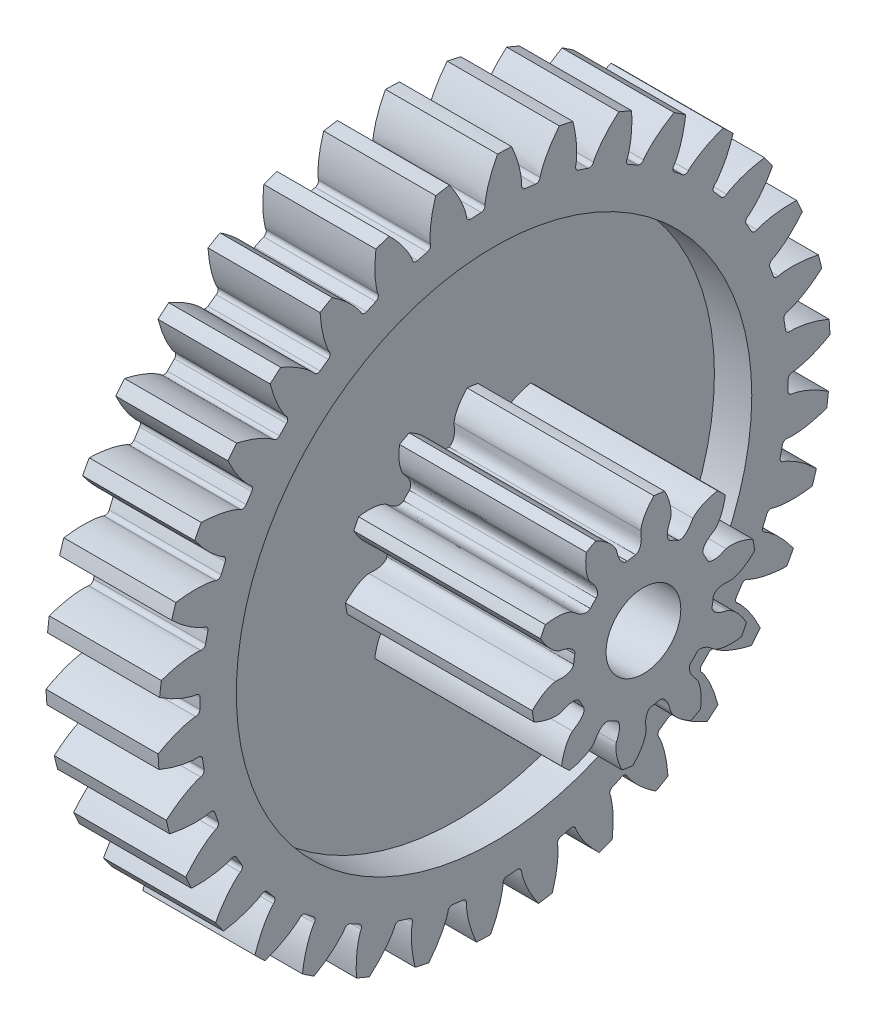
from build123d import *

# Parameters (mm, degrees)
ESQUISSE2_R             = 1
BOSS_EXTRU_1_DEPTH      = 3
ESQUISSE3_R             = 6.9
ENL_V_MAT_EXTRU_1_DEPTH = 1
ESQUISSE4_R             = 1
BOSS_EXTRU_2_DEPTH      = 5


with BuildPart() as part:
    # Esquisse2 → Boss.-Extru.1 (new body)
    with BuildSketch(Plane(origin=(0, 0, 0), x_dir=(0, 0, -1), z_dir=(1, 0, 0))):
        with BuildLine():
            ThreePointArc((8.992678526, 0.362950305), (8.983203595, 0.549593642), (8.969855294, 0.736000007))
            add(Edge.make_bspline(
                [(7.928017131, 0.973718567), (7.968735547, 0.978720051), (8.14599471, 0.972060465), (8.43210917, 0.923262044), (8.735368899, 0.829543111), (8.90576586, 0.762906571), (8.969855294, 0.736000007)],
                knots=[0, 0, 0, 0, 0.124841327, 0.52877899, 0.867841808, 1.076016146, 1.076016146, 1.076016146, 1.076016146], degree=3))
            ThreePointArc((7.928017131, 0.973718567), (7.845145349, 0.995861242), (7.801971612, 1.069983161))
            ThreePointArc((7.801971612, 1.069983161), (7.782401197, 1.204099918), (7.760525474, 1.337859996))
            ThreePointArc((7.760525474, 1.337859996), (7.7791127, 1.421320515), (7.851006147, 1.467607399))
            add(Edge.make_bspline(
                [(7.851006147, 1.467607399), (7.891911369, 1.47525391), (8.058869705, 1.535171146), (8.316858832, 1.668153777), (8.577616241, 1.849137964), (8.719907754, 1.964153953), (8.772869142, 2.009170729)],
                knots=[0, 0, 0, 0, 0.124841327, 0.52877899, 0.867841808, 1.076016146, 1.076016146, 1.076016146, 1.076016146], degree=3))
            ThreePointArc((8.772869142, 2.009170729), (8.729259916, 2.190895095), (8.681886815, 2.371674793))
            add(Edge.make_bspline(
                [(7.614107256, 2.413908484), (7.653213344, 2.426306797), (7.828678029, 2.452331888), (8.118887532, 2.456937748), (8.434204497, 2.420538386), (8.613944558, 2.38634682), (8.681886815, 2.371674793)],
                knots=[0, 0, 0, 0, 0.124841327, 0.52877899, 0.867841808, 1.076016146, 1.076016146, 1.076016146, 1.076016146], degree=3))
            ThreePointArc((7.614107256, 2.413908484), (7.528577818, 2.420446487), (7.472519329, 2.485373186))
            ThreePointArc((7.472519329, 2.485373186), (7.428638248, 2.613610296), (7.382556651, 2.741073201))
            ThreePointArc((7.382556651, 2.741073201), (7.385491564, 2.82652804), (7.447655696, 2.885237188))
            add(Edge.make_bspline(
                [(7.447655696, 2.885237188), (7.486459386, 2.900269817), (7.639565176, 2.989845363), (7.868726054, 3.167969089), (8.091787815, 3.393785724), (8.210522412, 3.532989345), (8.254310221, 3.586971254)],
                knots=[0, 0, 0, 0, 0.124841327, 0.52877899, 0.867841808, 1.076016146, 1.076016146, 1.076016146, 1.076016146], degree=3))
            ThreePointArc((8.254310221, 3.586971254), (8.17805176, 3.757588243), (8.098267094, 3.926585039))
            add(Edge.make_bspline(
                [(7.040908091, 3.771895641), (7.077070139, 3.791268575), (7.244765106, 3.849092091), (7.529186917, 3.906945383), (7.845823377, 3.92910513), (8.028785705, 3.928522889), (8.098267094, 3.926585039)],
                knots=[0, 0, 0, 0, 0.124841327, 0.52877899, 0.867841808, 1.076016146, 1.076016146, 1.076016146, 1.076016146], degree=3))
            ThreePointArc((7.040908091, 3.771895641), (6.955633599, 3.76260633), (6.888599363, 3.816126808))
            ThreePointArc((6.888599363, 3.816126808), (6.821901934, 3.93411731), (6.753183716, 4.050942446))
            ThreePointArc((6.753183716, 4.050942446), (6.740366371, 4.135481543), (6.790684263, 4.204613685))
            add(Edge.make_bspline(
                [(6.790684263, 4.204613685), (6.826065008, 4.226520515), (6.960104418, 4.342703981), (7.152633247, 4.559903013), (7.33040326, 4.822862182), (7.421537577, 4.981513022), (7.454660665, 5.042621775)],
                knots=[0, 0, 0, 0, 0.124841327, 0.52877899, 0.867841808, 1.076016146, 1.076016146, 1.076016146, 1.076016146], degree=3))
            ThreePointArc((7.454660665, 5.042621775), (7.34834986, 5.19632123), (7.2388706, 5.34778014))
            add(Edge.make_bspline(
                [(6.227939246, 5.001435417), (6.259925799, 5.027123248), (6.414140397, 5.114776078), (6.683088872, 5.223906679), (6.990262151, 5.303870911), (7.170216185, 5.336917824), (7.2388706, 5.34778014)],
                knots=[0, 0, 0, 0, 0.124841327, 0.52877899, 0.867841808, 1.076016146, 1.076016146, 1.076016146, 1.076016146], degree=3))
            ThreePointArc((6.227939246, 5.001435417), (6.14582362, 4.976635127), (6.070096408, 5.016926809))
            ThreePointArc((6.070096408, 5.016926809), (5.982853931, 5.120652678), (5.893839209, 5.222861704))
            ThreePointArc((5.893839209, 5.222861704), (5.865706085, 5.303606182), (5.902464222, 5.380807106))
            add(Edge.make_bspline(
                [(5.902464222, 5.380807106), (5.933217173, 5.408842125), (6.043625651, 5.547677024), (6.192966094, 5.79655491), (6.319390614, 6.087701853), (6.379821181, 6.260397247), (6.401151581, 6.32655186)],
                knots=[0, 0, 0, 0, 0.124841327, 0.52877899, 0.867841808, 1.076016146, 1.076016146, 1.076016146, 1.076016146], degree=3))
            ThreePointArc((6.401151581, 6.32655186), (6.268408719, 6.45809973), (6.13296305, 6.586863003))
            add(Edge.make_bspline(
                [(5.202885399, 6.060657308), (5.229607193, 6.091785269), (5.36508983, 6.206282501), (5.60940625, 6.362974098), (5.896655932, 6.498019729), (6.067473552, 6.563570423), (6.13296305, 6.586863003)],
                knots=[0, 0, 0, 0, 0.124841327, 0.52877899, 0.867841808, 1.076016146, 1.076016146, 1.076016146, 1.076016146], degree=3))
            ThreePointArc((5.202885399, 6.060657308), (5.126724989, 6.021190583), (5.044883599, 6.046881384))
            ThreePointArc((5.044883599, 6.046881384), (4.940067013, 6.13281036), (4.833787077, 6.216922671))
            ThreePointArc((4.833787077, 6.216922671), (4.791296214, 6.291122873), (4.813242841, 6.373763594))
            add(Edge.make_bspline(
                [(4.813242841, 6.373763594), (4.838320743, 6.406972104), (4.921338461, 6.563730579), (5.022404908, 6.835812081), (5.0931787, 7.145232139), (5.120847626, 7.326091153), (5.129658958, 7.395038808)],
                knots=[0, 0, 0, 0, 0.124841327, 0.52877899, 0.867841808, 1.076016146, 1.076016146, 1.076016146, 1.076016146], degree=3))
            ThreePointArc((5.129658958, 7.395038808), (4.975004437, 7.49995539), (4.818204799, 7.601638147))
            add(Edge.make_bspline(
                [(4.00065353, 6.913490784), (4.021200587, 6.948998848), (4.133337563, 7.086441417), (4.344702027, 7.285358066), (4.602246167, 7.470886279), (4.758110384, 7.566708503), (4.818204799, 7.601638147)],
                knots=[0, 0, 0, 0, 0.124841327, 0.52877899, 0.867841808, 1.076016146, 1.076016146, 1.076016146, 1.076016146], degree=3))
            ThreePointArc((4.00065353, 6.913490784), (3.933041887, 6.860701616), (3.84787333, 6.870916666))
            ThreePointArc((3.84787333, 6.870916666), (3.729052038, 6.936122541), (3.609126123, 6.999273793))
            ThreePointArc((3.609126123, 6.999273793), (3.553724497, 7.06440292), (3.560112248, 7.149669208))
            add(Edge.make_bspline(
                [(3.560112248, 7.149669208), (3.578661103, 7.186920332), (3.631460993, 7.356264162), (3.680811746, 7.64228387), (3.693524693, 7.959440113), (3.687489747, 8.142303811), (3.683481951, 8.21169658)],
                knots=[0, 0, 0, 0, 0.124841327, 0.52877899, 0.867841808, 1.076016146, 1.076016146, 1.076016146, 1.076016146], degree=3))
            ThreePointArc((3.683481951, 8.21169658), (3.512182346, 8.286409063), (3.339368362, 8.35754862))
            add(Edge.make_bspline(
                [(2.662184203, 7.530893622), (2.675856818, 7.569572607), (2.760829443, 7.72528007), (2.932044187, 7.959647903), (3.151112429, 8.189340757), (3.286715474, 8.3121714), (3.339368362, 8.35754862)],
                knots=[0, 0, 0, 0, 0.124841327, 0.52877899, 0.867841808, 1.076016146, 1.076016146, 1.076016146, 1.076016146], degree=3))
            ThreePointArc((2.662184203, 7.530893622), (2.605423761, 7.466579684), (2.51982835, 7.460971122))
            ThreePointArc((2.51982835, 7.460971122), (2.391048668, 7.503233388), (2.261560708, 7.543273041))
            ThreePointArc((2.261560708, 7.543273041), (2.195134954, 7.597113198), (2.185746302, 7.682101412))
            add(Edge.make_bspline(
                [(2.185746302, 7.682101412), (2.197134452, 7.722126608), (2.217918476, 7.898288992), (2.213872956, 8.188506848), (2.168092134, 8.502598901), (2.128558827, 8.681240079), (2.111868384, 8.748714873)],
                knots=[0, 0, 0, 0, 0.124841327, 0.52877899, 0.867841808, 1.076016146, 1.076016146, 1.076016146, 1.076016146], degree=3))
            ThreePointArc((2.111868384, 8.748714873), (1.929757098, 8.790679015), (1.74681374, 8.8288528))
            add(Edge.make_bspline(
                [(1.233057386, 7.891840911), (1.239389954, 7.932373648), (1.294304588, 8.101043575), (1.419539098, 8.362881478), (1.592671336, 8.628917058), (1.70339541, 8.77457327), (1.74681374, 8.8288528)],
                knots=[0, 0, 0, 0, 0.124841327, 0.52877899, 0.867841808, 1.076016146, 1.076016146, 1.076016146, 1.076016146], degree=3))
            ThreePointArc((1.233057386, 7.891840911), (1.189081054, 7.818192336), (1.105973638, 7.796951155))
            ThreePointArc((1.105973638, 7.796951155), (0.971621004, 7.81483062), (0.836980555, 7.830395172))
            ThreePointArc((0.836980555, 7.830395172), (0.761792723, 7.871112898), (0.736947387, 7.952928866))
            add(Edge.make_bspline(
                [(0.736947387, 7.952928866), (0.740787022, 7.994365125), (0.728847405, 8.171347063), (0.671543377, 8.455880046), (0.568827797, 8.756211882), (0.49714239, 8.924547128), (0.468337672, 8.987806174)],
                knots=[0, 0, 0, 0, 0.124841327, 0.52877899, 0.867841808, 1.076016146, 1.076016146, 1.076016146, 1.076016146], degree=3))
            ThreePointArc((0.468337672, 8.987806174), (0.281616286, 8.995592936), (0.094773472, 8.999500986))
            add(Edge.make_bspline(
                [(-0.238059721, 7.984041022), (-0.239282848, 8.02504722), (-0.216296258, 8.200935757), (-0.141306691, 8.481327153), (-0.020006268, 8.774645937), (0.062068259, 8.938167571), (0.094773472, 8.999500986)],
                knots=[0, 0, 0, 0, 0.124841327, 0.52877899, 0.867841808, 1.076016146, 1.076016146, 1.076016146, 1.076016146], degree=3))
            ThreePointArc((-0.238059721, 7.984041022), (-0.267754383, 7.903565825), (-0.34554368, 7.867415368))
            ThreePointArc((-0.34554368, 7.867415368), (-0.480894049, 7.860303169), (-0.616101967, 7.850862587))
            ThreePointArc((-0.616101967, 7.850862587), (-0.697491446, 7.877071289), (-0.736947387, 7.952928866))
            add(Edge.make_bspline(
                [(-0.736947387, 7.952928866), (-0.740787022, 7.994365125), (-0.78504369, 8.166139711), (-0.893654807, 8.435298391), (-1.049807289, 8.711642568), (-1.151203635, 8.863939428), (-1.191141718, 8.920828516)],
                knots=[0, 0, 0, 0, 0.124841327, 0.52877899, 0.867841808, 1.076016146, 1.076016146, 1.076016146, 1.076016146], degree=3))
            ThreePointArc((-1.191141718, 8.920828516), (-1.376114631, 8.894172728), (-1.560494193, 8.863681959))
            add(Edge.make_bspline(
                [(-1.70106999, 7.804354193), (-1.70980716, 7.844437433), (-1.719531394, 8.021554909), (-1.697340451, 8.310951405), (-1.632002584, 8.621564774), (-1.581372552, 8.797383295), (-1.560494193, 8.863681959)],
                knots=[0, 0, 0, 0, 0.124841327, 0.52877899, 0.867841808, 1.076016146, 1.076016146, 1.076016146, 1.076016146], degree=3))
            ThreePointArc((-1.70106999, 7.804354193), (-1.715471765, 7.719792859), (-1.785293922, 7.669964186))
            ThreePointArc((-1.785293922, 7.669964186), (-1.917032831, 7.638102521), (-2.048203875, 7.603978293))
            ThreePointArc((-2.048203875, 7.603978293), (-2.13302338, 7.614785465), (-2.185746302, 7.682101412))
            add(Edge.make_bspline(
                [(-2.185746302, 7.682101412), (-2.197134452, 7.722126608), (-2.272201064, 7.882844264), (-2.428420647, 8.127462766), (-2.632692446, 8.370408715), (-2.760346802, 8.501480902), (-2.810058205, 8.550062742)],
                knots=[0, 0, 0, 0, 0.124841327, 0.52877899, 0.867841808, 1.076016146, 1.076016146, 1.076016146, 1.076016146], degree=3))
            ThreePointArc((-2.810058205, 8.550062742), (-2.986983615, 8.489872136), (-3.1626211, 8.426020875))
            add(Edge.make_bspline(
                [(-3.106152361, 7.358899441), (-3.12210604, 7.396694737), (-3.164209951, 7.569009628), (-3.195573318, 7.857556174), (-3.188423008, 8.174886562), (-3.170961618, 8.357014683), (-3.1626211, 8.426020875)],
                knots=[0, 0, 0, 0, 0.124841327, 0.52877899, 0.867841808, 1.076016146, 1.076016146, 1.076016146, 1.076016146], degree=3))
            ThreePointArc((-3.106152361, 7.358899441), (-3.104770813, 7.273131606), (-3.164248122, 7.211321573))
            ThreePointArc((-3.164248122, 7.211321573), (-3.287889359, 7.155795453), (-3.410556657, 7.098149639))
            ThreePointArc((-3.410556657, 7.098149639), (-3.49591776, 7.093187254), (-3.560112248, 7.149669208))
            add(Edge.make_bspline(
                [(-3.560112248, 7.149669208), (-3.578661103, 7.186920332), (-3.681981355, 7.331108011), (-3.880489536, 7.542856145), (-4.125924419, 7.744130633), (-4.275489668, 7.84951464), (-4.33328153, 7.888134836)],
                knots=[0, 0, 0, 0, 0.124841327, 0.52877899, 0.867841808, 1.076016146, 1.076016146, 1.076016146, 1.076016146], degree=3))
            ThreePointArc((-4.33328153, 7.888134836), (-4.496134454, 7.79645913), (-4.657048739, 7.701421755))
            add(Edge.make_bspline(
                [(-4.405458438, 6.662846196), (-4.428085343, 6.697066474), (-4.501135134, 6.858710803), (-4.584984768, 7.136581292), (-4.636265512, 7.449822393), (-4.652567389, 7.632057959), (-4.657048739, 7.701421755)],
                knots=[0, 0, 0, 0, 0.124841327, 0.52877899, 0.867841808, 1.076016146, 1.076016146, 1.076016146, 1.076016146], degree=3))
            ThreePointArc((-4.405458438, 6.662846196), (-4.388340616, 6.578792579), (-4.435447646, 6.507106053))
            ThreePointArc((-4.435447646, 6.507106053), (-4.546780759, 6.429806352), (-4.656767022, 6.350602011))
            ThreePointArc((-4.656767022, 6.350602011), (-4.739762855, 6.330039059), (-4.813242841, 6.373763594))
            add(Edge.make_bspline(
                [(-4.813242841, 6.373763594), (-4.838320743, 6.406972104), (-4.966376188, 6.529719667), (-5.200413007, 6.701386604), (-5.478652985, 6.85413547), (-5.645035862, 6.930242572), (-5.70894015, 6.957585958)],
                knots=[0, 0, 0, 0, 0.124841327, 0.52877899, 0.867841808, 1.076016146, 1.076016146, 1.076016146, 1.076016146], degree=3))
            ThreePointArc((-5.70894015, 6.957585958), (-5.852174827, 6.83754706), (-5.992886168, 6.714559954))
            add(Edge.make_bspline(
                [(-5.554741912, 5.739897714), (-5.58327151, 5.769377644), (-5.684779557, 5.914846807), (-5.81826006, 6.172578694), (-5.926225553, 6.471063457), (-5.975735558, 6.647200654), (-5.992886168, 6.714559954)],
                knots=[0, 0, 0, 0, 0.124841327, 0.52877899, 0.867841808, 1.076016146, 1.076016146, 1.076016146, 1.076016146], degree=3))
            ThreePointArc((-5.554741912, 5.739897714), (-5.522470742, 5.660420661), (-5.555603321, 5.58129884))
            ThreePointArc((-5.555603321, 5.58129884), (-5.650836993, 5.484857908), (-5.744396771, 5.386792249))
            ThreePointArc((-5.744396771, 5.386792249), (-5.82220101, 5.351328976), (-5.902464222, 5.380807106))
            add(Edge.make_bspline(
                [(-5.902464222, 5.380807106), (-5.933217173, 5.408842125), (-6.081647036, 5.505969552), (-6.34324265, 5.63170938), (-6.644812595, 5.730730945), (-6.82234713, 5.774969405), (-6.89018766, 5.790104836)],
                knots=[0, 0, 0, 0, 0.124841327, 0.52877899, 0.867841808, 1.076016146, 1.076016146, 1.076016146, 1.076016146], degree=3))
            ThreePointArc((-6.89018766, 5.790104836), (-7.008926405, 5.645790525), (-7.124643046, 5.499041868))
            add(Edge.make_bspline(
                [(-6.514865313, 4.6214839), (-6.548326063, 4.645219578), (-6.674835631, 4.769559798), (-6.853401485, 4.998376331), (-7.014375092, 5.271940217), (-7.095407219, 5.435980904), (-7.124643046, 5.499041868)],
                knots=[0, 0, 0, 0, 0.124841327, 0.52877899, 0.867841808, 1.076016146, 1.076016146, 1.076016146, 1.076016146], degree=3))
            ThreePointArc((-6.514865313, 4.6214839), (-6.46853975, 4.549289907), (-6.486569587, 4.46542719))
            ThreePointArc((-6.486569587, 4.46542719), (-6.562460751, 4.353129207), (-6.636407979, 4.239541737))
            ThreePointArc((-6.636407979, 4.239541737), (-6.706371093, 4.190385802), (-6.790684263, 4.204613685))
            add(Edge.make_bspline(
                [(-6.790684263, 4.204613685), (-6.826065008, 4.226520515), (-6.989814688, 4.294720246), (-7.270060773, 4.370251048), (-7.584691081, 4.41217325), (-7.767331549, 4.423036581), (-7.836798093, 4.425448638)],
                knots=[0, 0, 0, 0, 0.124841327, 0.52877899, 0.867841808, 1.076016146, 1.076016146, 1.076016146, 1.076016146], degree=3))
            ThreePointArc((-7.836798093, 4.425448638), (-7.9269974, 4.261773366), (-8.013778751, 4.096260505))
            add(Edge.make_bspline(
                [(-7.253132789, 3.345690994), (-7.290385226, 3.362874131), (-7.437588183, 3.46185115), (-7.655158542, 3.653960257), (-7.863658499, 3.893287376), (-7.973453297, 4.039645344), (-8.013778751, 4.096260505)],
                knots=[0, 0, 0, 0, 0.124841327, 0.52877899, 0.867841808, 1.076016146, 1.076016146, 1.076016146, 1.076016146], degree=3))
            ThreePointArc((-7.253132789, 3.345690994), (-7.194330395, 3.283238541), (-7.196643507, 3.197490772))
            ThreePointArc((-7.196643507, 3.197490772), (-7.250607779, 3.073159911), (-7.302424271, 2.947918717))
            ThreePointArc((-7.302424271, 2.947918717), (-7.362163751, 2.886744066), (-7.447655696, 2.885237188))
            add(Edge.make_bspline(
                [(-7.447655696, 2.885237188), (-7.486459386, 2.900269817), (-7.659952585, 2.937219394), (-7.949305695, 2.959969057), (-8.266282009, 2.943364287), (-8.447808808, 2.920482551), (-8.516535767, 2.910089094)],
                knots=[0, 0, 0, 0, 0.124841327, 0.52877899, 0.867841808, 1.076016146, 1.076016146, 1.076016146, 1.076016146], degree=3))
            ThreePointArc((-8.516535767, 2.910089094), (-8.575124006, 2.732626625), (-8.630014832, 2.553985905))
            add(Edge.make_bspline(
                [(-7.744403527, 1.955964595), (-7.784179063, 1.966010038), (-7.94706259, 2.036253313), (-8.196228356, 2.185112949), (-8.445154448, 2.382053302), (-8.579972987, 2.505744507), (-8.630014832, 2.553985905)],
                knots=[0, 0, 0, 0, 0.124841327, 0.52877899, 0.867841808, 1.076016146, 1.076016146, 1.076016146, 1.076016146], degree=3))
            ThreePointArc((-7.744403527, 1.955964595), (-7.675126748, 1.905380425), (-7.661644363, 1.820667641))
            ThreePointArc((-7.661644363, 1.820667641), (-7.691844055, 1.68853784), (-7.719765264, 1.55590786))
            ThreePointArc((-7.719765264, 1.55590786), (-7.767246753, 1.484797724), (-7.851006147, 1.467607399))
            add(Edge.make_bspline(
                [(-7.851006147, 1.467607399), (-7.891911369, 1.47525391), (-8.069239983, 1.479695059), (-8.357846547, 1.448888871), (-8.666374618, 1.374322583), (-8.84060607, 1.318474991), (-8.906253029, 1.295629957)],
                knots=[0, 0, 0, 0, 0.124841327, 0.52877899, 0.867841808, 1.076016146, 1.076016146, 1.076016146, 1.076016146], degree=3))
            ThreePointArc((-8.906253029, 1.295629957), (-8.93123505, 1.110423563), (-8.952366108, 0.924738377))
            add(Edge.make_bspline(
                [(-7.971947891, 0.499630167), (-8.012892019, 0.502195832), (-8.185909312, 0.541313312), (-8.458185443, 0.641854241), (-8.73906079, 0.78970126), (-8.894311987, 0.886513545), (-8.952366108, 0.924738377)],
                knots=[0, 0, 0, 0, 0.124841327, 0.52877899, 0.867841808, 1.076016146, 1.076016146, 1.076016146, 1.076016146], degree=3))
            ThreePointArc((-7.971947891, 0.499630167), (-7.894555864, 0.462636863), (-7.865737109, 0.381843858))
            ThreePointArc((-7.865737109, 0.381843858), (-7.871143807, 0.246414639), (-7.874218909, 0.110912427))
            ThreePointArc((-7.874218909, 0.110912427), (-7.907825483, 0.032288375), (-7.987, 0))
            add(Edge.make_bspline(
                [(-7.987, 0), (-8.028613776, 0), (-8.203739092, -0.028218518), (-8.481770958, -0.111531489), (-8.771344233, -0.241520028), (-8.932347096, -0.328431654), (-8.992678526, -0.362950305)],
                knots=[0, 0, 0, 0, 0.124841327, 0.52877899, 0.867841808, 1.076016146, 1.076016146, 1.076016146, 1.076016146], degree=3))
            ThreePointArc((-8.992678526, -0.362950305), (-8.983203595, -0.549593642), (-8.969855294, -0.736000007))
            add(Edge.make_bspline(
                [(-7.928017131, -0.973718567), (-7.968735547, -0.978720051), (-8.14599471, -0.972060465), (-8.43210917, -0.923262044), (-8.735368899, -0.829543111), (-8.90576586, -0.762906571), (-8.969855294, -0.736000007)],
                knots=[0, 0, 0, 0, 0.124841327, 0.52877899, 0.867841808, 1.076016146, 1.076016146, 1.076016146, 1.076016146], degree=3))
            ThreePointArc((-7.928017131, -0.973718567), (-7.845145349, -0.995861242), (-7.801971612, -1.069983161))
            ThreePointArc((-7.801971612, -1.069983161), (-7.782401197, -1.204099918), (-7.760525474, -1.337859996))
            ThreePointArc((-7.760525474, -1.337859996), (-7.7791127, -1.421320515), (-7.851006147, -1.467607399))
            add(Edge.make_bspline(
                [(-7.851006147, -1.467607399), (-7.891911369, -1.47525391), (-8.058869705, -1.535171146), (-8.316858832, -1.668153777), (-8.577616241, -1.849137964), (-8.719907754, -1.964153953), (-8.772869142, -2.009170729)],
                knots=[0, 0, 0, 0, 0.124841327, 0.52877899, 0.867841808, 1.076016146, 1.076016146, 1.076016146, 1.076016146], degree=3))
            ThreePointArc((-8.772869142, -2.009170729), (-8.729259916, -2.190895095), (-8.681886815, -2.371674793))
            add(Edge.make_bspline(
                [(-7.614107256, -2.413908484), (-7.653213344, -2.426306797), (-7.828678029, -2.452331888), (-8.118887532, -2.456937748), (-8.434204497, -2.420538386), (-8.613944558, -2.38634682), (-8.681886815, -2.371674793)],
                knots=[0, 0, 0, 0, 0.124841327, 0.52877899, 0.867841808, 1.076016146, 1.076016146, 1.076016146, 1.076016146], degree=3))
            ThreePointArc((-7.614107256, -2.413908484), (-7.528577818, -2.420446487), (-7.472519329, -2.485373186))
            ThreePointArc((-7.472519329, -2.485373186), (-7.428638248, -2.613610296), (-7.382556651, -2.741073201))
            ThreePointArc((-7.382556651, -2.741073201), (-7.385491564, -2.82652804), (-7.447655696, -2.885237188))
            add(Edge.make_bspline(
                [(-7.447655696, -2.885237188), (-7.486459386, -2.900269817), (-7.639565176, -2.989845363), (-7.868726054, -3.167969089), (-8.091787815, -3.393785724), (-8.210522412, -3.532989345), (-8.254310221, -3.586971254)],
                knots=[0, 0, 0, 0, 0.124841327, 0.52877899, 0.867841808, 1.076016146, 1.076016146, 1.076016146, 1.076016146], degree=3))
            ThreePointArc((-8.254310221, -3.586971254), (-8.17805176, -3.757588243), (-8.098267094, -3.926585039))
            add(Edge.make_bspline(
                [(-7.040908091, -3.771895641), (-7.077070139, -3.791268575), (-7.244765106, -3.849092091), (-7.529186917, -3.906945383), (-7.845823377, -3.92910513), (-8.028785705, -3.928522889), (-8.098267094, -3.926585039)],
                knots=[0, 0, 0, 0, 0.124841327, 0.52877899, 0.867841808, 1.076016146, 1.076016146, 1.076016146, 1.076016146], degree=3))
            ThreePointArc((-7.040908091, -3.771895641), (-6.955633599, -3.76260633), (-6.888599363, -3.816126808))
            ThreePointArc((-6.888599363, -3.816126808), (-6.821901934, -3.93411731), (-6.753183716, -4.050942446))
            ThreePointArc((-6.753183716, -4.050942446), (-6.740366371, -4.135481543), (-6.790684263, -4.204613685))
            add(Edge.make_bspline(
                [(-6.790684263, -4.204613685), (-6.826065008, -4.226520515), (-6.960104418, -4.342703981), (-7.152633247, -4.559903013), (-7.33040326, -4.822862182), (-7.421537577, -4.981513022), (-7.454660665, -5.042621775)],
                knots=[0, 0, 0, 0, 0.124841327, 0.52877899, 0.867841808, 1.076016146, 1.076016146, 1.076016146, 1.076016146], degree=3))
            ThreePointArc((-7.454660665, -5.042621775), (-7.34834986, -5.19632123), (-7.2388706, -5.34778014))
            add(Edge.make_bspline(
                [(-6.227939246, -5.001435417), (-6.259925799, -5.027123248), (-6.414140397, -5.114776078), (-6.683088872, -5.223906679), (-6.990262151, -5.303870911), (-7.170216185, -5.336917824), (-7.2388706, -5.34778014)],
                knots=[0, 0, 0, 0, 0.124841327, 0.52877899, 0.867841808, 1.076016146, 1.076016146, 1.076016146, 1.076016146], degree=3))
            ThreePointArc((-6.227939246, -5.001435417), (-6.14582362, -4.976635127), (-6.070096408, -5.016926809))
            ThreePointArc((-6.070096408, -5.016926809), (-5.982853931, -5.120652678), (-5.893839209, -5.222861704))
            ThreePointArc((-5.893839209, -5.222861704), (-5.865706085, -5.303606182), (-5.902464222, -5.380807106))
            add(Edge.make_bspline(
                [(-5.902464222, -5.380807106), (-5.933217173, -5.408842125), (-6.043625651, -5.547677024), (-6.192966094, -5.79655491), (-6.319390614, -6.087701853), (-6.379821181, -6.260397247), (-6.401151581, -6.32655186)],
                knots=[0, 0, 0, 0, 0.124841327, 0.52877899, 0.867841808, 1.076016146, 1.076016146, 1.076016146, 1.076016146], degree=3))
            ThreePointArc((-6.401151581, -6.32655186), (-6.268408719, -6.45809973), (-6.13296305, -6.586863003))
            add(Edge.make_bspline(
                [(-5.202885399, -6.060657308), (-5.229607193, -6.091785269), (-5.36508983, -6.206282501), (-5.60940625, -6.362974098), (-5.896655932, -6.498019729), (-6.067473552, -6.563570423), (-6.13296305, -6.586863003)],
                knots=[0, 0, 0, 0, 0.124841327, 0.52877899, 0.867841808, 1.076016146, 1.076016146, 1.076016146, 1.076016146], degree=3))
            ThreePointArc((-5.202885399, -6.060657308), (-5.126724989, -6.021190583), (-5.044883599, -6.046881384))
            ThreePointArc((-5.044883599, -6.046881384), (-4.940067013, -6.13281036), (-4.833787077, -6.216922671))
            ThreePointArc((-4.833787077, -6.216922671), (-4.791296214, -6.291122873), (-4.813242841, -6.373763594))
            add(Edge.make_bspline(
                [(-4.813242841, -6.373763594), (-4.838320743, -6.406972104), (-4.921338461, -6.563730579), (-5.022404908, -6.835812081), (-5.0931787, -7.145232139), (-5.120847626, -7.326091153), (-5.129658958, -7.395038808)],
                knots=[0, 0, 0, 0, 0.124841327, 0.52877899, 0.867841808, 1.076016146, 1.076016146, 1.076016146, 1.076016146], degree=3))
            ThreePointArc((-5.129658958, -7.395038808), (-4.975004437, -7.49995539), (-4.818204799, -7.601638147))
            add(Edge.make_bspline(
                [(-4.00065353, -6.913490784), (-4.021200587, -6.948998848), (-4.133337563, -7.086441417), (-4.344702027, -7.285358066), (-4.602246167, -7.470886279), (-4.758110384, -7.566708503), (-4.818204799, -7.601638147)],
                knots=[0, 0, 0, 0, 0.124841327, 0.52877899, 0.867841808, 1.076016146, 1.076016146, 1.076016146, 1.076016146], degree=3))
            ThreePointArc((-4.00065353, -6.913490784), (-3.933041887, -6.860701616), (-3.84787333, -6.870916666))
            ThreePointArc((-3.84787333, -6.870916666), (-3.729052038, -6.936122541), (-3.609126123, -6.999273793))
            ThreePointArc((-3.609126123, -6.999273793), (-3.553724497, -7.06440292), (-3.560112248, -7.149669208))
            add(Edge.make_bspline(
                [(-3.560112248, -7.149669208), (-3.578661103, -7.186920332), (-3.631460993, -7.356264162), (-3.680811746, -7.64228387), (-3.693524693, -7.959440113), (-3.687489747, -8.142303811), (-3.683481951, -8.21169658)],
                knots=[0, 0, 0, 0, 0.124841327, 0.52877899, 0.867841808, 1.076016146, 1.076016146, 1.076016146, 1.076016146], degree=3))
            ThreePointArc((-3.683481951, -8.21169658), (-3.512182346, -8.286409063), (-3.339368362, -8.35754862))
            add(Edge.make_bspline(
                [(-2.662184203, -7.530893622), (-2.675856818, -7.569572607), (-2.760829443, -7.72528007), (-2.932044187, -7.959647903), (-3.151112429, -8.189340757), (-3.286715474, -8.3121714), (-3.339368362, -8.35754862)],
                knots=[0, 0, 0, 0, 0.124841327, 0.52877899, 0.867841808, 1.076016146, 1.076016146, 1.076016146, 1.076016146], degree=3))
            ThreePointArc((-2.662184203, -7.530893622), (-2.605423761, -7.466579684), (-2.51982835, -7.460971122))
            ThreePointArc((-2.51982835, -7.460971122), (-2.391048668, -7.503233388), (-2.261560708, -7.543273041))
            ThreePointArc((-2.261560708, -7.543273041), (-2.195134954, -7.597113198), (-2.185746302, -7.682101412))
            add(Edge.make_bspline(
                [(-2.185746302, -7.682101412), (-2.197134452, -7.722126608), (-2.217918476, -7.898288992), (-2.213872956, -8.188506848), (-2.168092134, -8.502598901), (-2.128558827, -8.681240079), (-2.111868384, -8.748714873)],
                knots=[0, 0, 0, 0, 0.124841327, 0.52877899, 0.867841808, 1.076016146, 1.076016146, 1.076016146, 1.076016146], degree=3))
            ThreePointArc((-2.111868384, -8.748714873), (-1.929757098, -8.790679015), (-1.74681374, -8.8288528))
            add(Edge.make_bspline(
                [(-1.233057386, -7.891840911), (-1.239389954, -7.932373648), (-1.294304588, -8.101043575), (-1.419539098, -8.362881478), (-1.592671336, -8.628917058), (-1.70339541, -8.77457327), (-1.74681374, -8.8288528)],
                knots=[0, 0, 0, 0, 0.124841327, 0.52877899, 0.867841808, 1.076016146, 1.076016146, 1.076016146, 1.076016146], degree=3))
            ThreePointArc((-1.233057386, -7.891840911), (-1.189081054, -7.818192336), (-1.105973638, -7.796951155))
            ThreePointArc((-1.105973638, -7.796951155), (-0.971621004, -7.81483062), (-0.836980555, -7.830395172))
            ThreePointArc((-0.836980555, -7.830395172), (-0.761792723, -7.871112898), (-0.736947387, -7.952928866))
            add(Edge.make_bspline(
                [(-0.736947387, -7.952928866), (-0.740787022, -7.994365125), (-0.728847405, -8.171347063), (-0.671543377, -8.455880046), (-0.568827797, -8.756211882), (-0.49714239, -8.924547128), (-0.468337672, -8.987806174)],
                knots=[0, 0, 0, 0, 0.124841327, 0.52877899, 0.867841808, 1.076016146, 1.076016146, 1.076016146, 1.076016146], degree=3))
            ThreePointArc((-0.468337672, -8.987806174), (-0.281616286, -8.995592936), (-0.094773472, -8.999500986))
            add(Edge.make_bspline(
                [(0.238059721, -7.984041022), (0.239282848, -8.02504722), (0.216296258, -8.200935757), (0.141306691, -8.481327153), (0.020006268, -8.774645937), (-0.062068259, -8.938167571), (-0.094773472, -8.999500986)],
                knots=[0, 0, 0, 0, 0.124841327, 0.52877899, 0.867841808, 1.076016146, 1.076016146, 1.076016146, 1.076016146], degree=3))
            ThreePointArc((0.238059721, -7.984041022), (0.267754383, -7.903565825), (0.34554368, -7.867415368))
            ThreePointArc((0.34554368, -7.867415368), (0.480894049, -7.860303169), (0.616101967, -7.850862587))
            ThreePointArc((0.616101967, -7.850862587), (0.697491446, -7.877071289), (0.736947387, -7.952928866))
            add(Edge.make_bspline(
                [(0.736947387, -7.952928866), (0.740787022, -7.994365125), (0.78504369, -8.166139711), (0.893654807, -8.435298391), (1.049807289, -8.711642568), (1.151203635, -8.863939428), (1.191141718, -8.920828516)],
                knots=[0, 0, 0, 0, 0.124841327, 0.52877899, 0.867841808, 1.076016146, 1.076016146, 1.076016146, 1.076016146], degree=3))
            ThreePointArc((1.191141718, -8.920828516), (1.376114631, -8.894172728), (1.560494193, -8.863681959))
            add(Edge.make_bspline(
                [(1.70106999, -7.804354193), (1.70980716, -7.844437433), (1.719531394, -8.021554909), (1.697340451, -8.310951405), (1.632002584, -8.621564774), (1.581372552, -8.797383295), (1.560494193, -8.863681959)],
                knots=[0, 0, 0, 0, 0.124841327, 0.52877899, 0.867841808, 1.076016146, 1.076016146, 1.076016146, 1.076016146], degree=3))
            ThreePointArc((1.70106999, -7.804354193), (1.715471765, -7.719792859), (1.785293922, -7.669964186))
            ThreePointArc((1.785293922, -7.669964186), (1.917032831, -7.638102521), (2.048203875, -7.603978293))
            ThreePointArc((2.048203875, -7.603978293), (2.13302338, -7.614785465), (2.185746302, -7.682101412))
            add(Edge.make_bspline(
                [(2.185746302, -7.682101412), (2.197134452, -7.722126608), (2.272201064, -7.882844264), (2.428420647, -8.127462766), (2.632692446, -8.370408715), (2.760346802, -8.501480902), (2.810058205, -8.550062742)],
                knots=[0, 0, 0, 0, 0.124841327, 0.52877899, 0.867841808, 1.076016146, 1.076016146, 1.076016146, 1.076016146], degree=3))
            ThreePointArc((2.810058205, -8.550062742), (2.986983615, -8.489872136), (3.1626211, -8.426020875))
            add(Edge.make_bspline(
                [(3.106152361, -7.358899441), (3.12210604, -7.396694737), (3.164209951, -7.569009628), (3.195573318, -7.857556174), (3.188423008, -8.174886562), (3.170961618, -8.357014683), (3.1626211, -8.426020875)],
                knots=[0, 0, 0, 0, 0.124841327, 0.52877899, 0.867841808, 1.076016146, 1.076016146, 1.076016146, 1.076016146], degree=3))
            ThreePointArc((3.106152361, -7.358899441), (3.104770813, -7.273131606), (3.164248122, -7.211321573))
            ThreePointArc((3.164248122, -7.211321573), (3.287889359, -7.155795453), (3.410556657, -7.098149639))
            ThreePointArc((3.410556657, -7.098149639), (3.49591776, -7.093187254), (3.560112248, -7.149669208))
            add(Edge.make_bspline(
                [(3.560112248, -7.149669208), (3.578661103, -7.186920332), (3.681981355, -7.331108011), (3.880489536, -7.542856145), (4.125924419, -7.744130633), (4.275489668, -7.84951464), (4.33328153, -7.888134836)],
                knots=[0, 0, 0, 0, 0.124841327, 0.52877899, 0.867841808, 1.076016146, 1.076016146, 1.076016146, 1.076016146], degree=3))
            ThreePointArc((4.33328153, -7.888134836), (4.496134454, -7.79645913), (4.657048739, -7.701421755))
            add(Edge.make_bspline(
                [(4.405458438, -6.662846196), (4.428085343, -6.697066474), (4.501135134, -6.858710803), (4.584984768, -7.136581292), (4.636265512, -7.449822393), (4.652567389, -7.632057959), (4.657048739, -7.701421755)],
                knots=[0, 0, 0, 0, 0.124841327, 0.52877899, 0.867841808, 1.076016146, 1.076016146, 1.076016146, 1.076016146], degree=3))
            ThreePointArc((4.405458438, -6.662846196), (4.388340616, -6.578792579), (4.435447646, -6.507106053))
            ThreePointArc((4.435447646, -6.507106053), (4.546780759, -6.429806352), (4.656767022, -6.350602011))
            ThreePointArc((4.656767022, -6.350602011), (4.739762855, -6.330039059), (4.813242841, -6.373763594))
            add(Edge.make_bspline(
                [(4.813242841, -6.373763594), (4.838320743, -6.406972104), (4.966376188, -6.529719667), (5.200413007, -6.701386604), (5.478652985, -6.85413547), (5.645035862, -6.930242572), (5.70894015, -6.957585958)],
                knots=[0, 0, 0, 0, 0.124841327, 0.52877899, 0.867841808, 1.076016146, 1.076016146, 1.076016146, 1.076016146], degree=3))
            ThreePointArc((5.70894015, -6.957585958), (5.852174827, -6.83754706), (5.992886168, -6.714559954))
            add(Edge.make_bspline(
                [(5.554741912, -5.739897714), (5.58327151, -5.769377644), (5.684779557, -5.914846807), (5.81826006, -6.172578694), (5.926225553, -6.471063457), (5.975735558, -6.647200654), (5.992886168, -6.714559954)],
                knots=[0, 0, 0, 0, 0.124841327, 0.52877899, 0.867841808, 1.076016146, 1.076016146, 1.076016146, 1.076016146], degree=3))
            ThreePointArc((5.554741912, -5.739897714), (5.522470742, -5.660420661), (5.555603321, -5.58129884))
            ThreePointArc((5.555603321, -5.58129884), (5.650836993, -5.484857908), (5.744396771, -5.386792249))
            ThreePointArc((5.744396771, -5.386792249), (5.82220101, -5.351328976), (5.902464222, -5.380807106))
            add(Edge.make_bspline(
                [(5.902464222, -5.380807106), (5.933217173, -5.408842125), (6.081647036, -5.505969552), (6.34324265, -5.63170938), (6.644812595, -5.730730945), (6.82234713, -5.774969405), (6.89018766, -5.790104836)],
                knots=[0, 0, 0, 0, 0.124841327, 0.52877899, 0.867841808, 1.076016146, 1.076016146, 1.076016146, 1.076016146], degree=3))
            ThreePointArc((6.89018766, -5.790104836), (7.008926405, -5.645790525), (7.124643046, -5.499041868))
            add(Edge.make_bspline(
                [(6.514865313, -4.6214839), (6.548326063, -4.645219578), (6.674835631, -4.769559798), (6.853401485, -4.998376331), (7.014375092, -5.271940217), (7.095407219, -5.435980904), (7.124643046, -5.499041868)],
                knots=[0, 0, 0, 0, 0.124841327, 0.52877899, 0.867841808, 1.076016146, 1.076016146, 1.076016146, 1.076016146], degree=3))
            ThreePointArc((6.514865313, -4.6214839), (6.46853975, -4.549289907), (6.486569587, -4.46542719))
            ThreePointArc((6.486569587, -4.46542719), (6.562460751, -4.353129207), (6.636407979, -4.239541737))
            ThreePointArc((6.636407979, -4.239541737), (6.706371093, -4.190385802), (6.790684263, -4.204613685))
            add(Edge.make_bspline(
                [(6.790684263, -4.204613685), (6.826065008, -4.226520515), (6.989814688, -4.294720246), (7.270060773, -4.370251048), (7.584691081, -4.41217325), (7.767331549, -4.423036581), (7.836798093, -4.425448638)],
                knots=[0, 0, 0, 0, 0.124841327, 0.52877899, 0.867841808, 1.076016146, 1.076016146, 1.076016146, 1.076016146], degree=3))
            ThreePointArc((7.836798093, -4.425448638), (7.9269974, -4.261773366), (8.013778751, -4.096260505))
            add(Edge.make_bspline(
                [(7.253132789, -3.345690994), (7.290385226, -3.362874131), (7.437588183, -3.46185115), (7.655158542, -3.653960257), (7.863658499, -3.893287376), (7.973453297, -4.039645344), (8.013778751, -4.096260505)],
                knots=[0, 0, 0, 0, 0.124841327, 0.52877899, 0.867841808, 1.076016146, 1.076016146, 1.076016146, 1.076016146], degree=3))
            ThreePointArc((7.253132789, -3.345690994), (7.194330395, -3.283238541), (7.196643507, -3.197490772))
            ThreePointArc((7.196643507, -3.197490772), (7.250607779, -3.073159911), (7.302424271, -2.947918717))
            ThreePointArc((7.302424271, -2.947918717), (7.362163751, -2.886744066), (7.447655696, -2.885237188))
            add(Edge.make_bspline(
                [(7.447655696, -2.885237188), (7.486459386, -2.900269817), (7.659952585, -2.937219394), (7.949305695, -2.959969057), (8.266282009, -2.943364287), (8.447808808, -2.920482551), (8.516535767, -2.910089094)],
                knots=[0, 0, 0, 0, 0.124841327, 0.52877899, 0.867841808, 1.076016146, 1.076016146, 1.076016146, 1.076016146], degree=3))
            ThreePointArc((8.516535767, -2.910089094), (8.575124006, -2.732626625), (8.630014832, -2.553985905))
            add(Edge.make_bspline(
                [(7.744403527, -1.955964595), (7.784179063, -1.966010038), (7.94706259, -2.036253313), (8.196228356, -2.185112949), (8.445154448, -2.382053302), (8.579972987, -2.505744507), (8.630014832, -2.553985905)],
                knots=[0, 0, 0, 0, 0.124841327, 0.52877899, 0.867841808, 1.076016146, 1.076016146, 1.076016146, 1.076016146], degree=3))
            ThreePointArc((7.744403527, -1.955964595), (7.675126748, -1.905380425), (7.661644363, -1.820667641))
            ThreePointArc((7.661644363, -1.820667641), (7.691844055, -1.68853784), (7.719765264, -1.55590786))
            ThreePointArc((7.719765264, -1.55590786), (7.767246753, -1.484797724), (7.851006147, -1.467607399))
            add(Edge.make_bspline(
                [(7.851006147, -1.467607399), (7.891911369, -1.47525391), (8.069239983, -1.479695059), (8.357846547, -1.448888871), (8.666374618, -1.374322583), (8.84060607, -1.318474991), (8.906253029, -1.295629957)],
                knots=[0, 0, 0, 0, 0.124841327, 0.52877899, 0.867841808, 1.076016146, 1.076016146, 1.076016146, 1.076016146], degree=3))
            ThreePointArc((8.906253029, -1.295629957), (8.93123505, -1.110423563), (8.952366108, -0.924738377))
            add(Edge.make_bspline(
                [(7.971947891, -0.499630167), (8.012892019, -0.502195832), (8.185909312, -0.541313312), (8.458185443, -0.641854241), (8.73906079, -0.78970126), (8.894311987, -0.886513545), (8.952366108, -0.924738377)],
                knots=[0, 0, 0, 0, 0.124841327, 0.52877899, 0.867841808, 1.076016146, 1.076016146, 1.076016146, 1.076016146], degree=3))
            ThreePointArc((7.971947891, -0.499630167), (7.894555864, -0.462636863), (7.865737109, -0.381843858))
            ThreePointArc((7.865737109, -0.381843858), (7.871143807, -0.246414639), (7.874218909, -0.110912427))
            ThreePointArc((7.874218909, -0.110912427), (7.907825483, -0.032288375), (7.987, 0))
            add(Edge.make_bspline(
                [(7.987, 0), (8.028613776, 0), (8.203739092, 0.028218518), (8.481770958, 0.111531489), (8.771344233, 0.241520028), (8.932347096, 0.328431654), (8.992678526, 0.362950305)],
                knots=[0, 0, 0, 0, 0.124841327, 0.52877899, 0.867841808, 1.076016146, 1.076016146, 1.076016146, 1.076016146], degree=3))
        make_face()
        Circle(ESQUISSE2_R, mode=Mode.SUBTRACT)
    extrude(amount=BOSS_EXTRU_1_DEPTH)

    # Esquisse3 → Enlèv. mat.-Extru.1 (cut)
    with BuildSketch(Plane(origin=(3, 0, 0), x_dir=(0, 0, -1), z_dir=(1, 0, 0))):
        Circle(ESQUISSE3_R)
    extrude(amount=-ENL_V_MAT_EXTRU_1_DEPTH, mode=Mode.SUBTRACT)

    # Esquisse4 → Boss.-Extru.2 (add)
    with BuildSketch(Plane(origin=(2, 0, 0), x_dir=(0, 0, -1), z_dir=(1, 0, 0))):
        with BuildLine():
            ThreePointArc((2.977310095, 0.368272455), (2.955741127, 0.513414445), (2.927100903, 0.657328154))
            add(Edge.make_bspline(
                [(2.211403727, 0.79214554), (2.222779445, 0.796220429), (2.274133198, 0.805614359), (2.359373738, 0.810478726), (2.538607422, 0.796225963), (2.732062921, 0.744216047), (2.878239296, 0.681280138), (2.927100903, 0.657328154)],
                knots=[0, 0, 0, 0, 0.036250587, 0.155621312, 0.255291203, 0.575254513, 0.744084786, 0.744084786, 0.744084786, 0.744084786], degree=3))
            add(Edge.make_bspline(
                [(2.211403727, 0.79214554), (2.132130324, 0.763749064), (1.99001212, 0.681956821), (1.750090704, 0.694113528), (1.707279056, 0.775127876)],
                knots=[0, 0, 0, 0, 0.252617676, 0.527509393, 0.527509393, 0.527509393, 0.527509393], degree=3))
            ThreePointArc((1.707279056, 0.775127876), (1.657764419, 0.876037746), (1.602292085, 0.973799299))
            add(Edge.make_bspline(
                [(1.90038092, 1.380707558), (1.832256922, 1.331212576), (1.684611138, 1.259880414), (1.559480437, 1.054813647), (1.602292085, 0.973799299)],
                knots=[0, 0, 0, 0, 0.252617676, 0.527509393, 0.527509393, 0.527509393, 0.527509393], degree=3))
            add(Edge.make_bspline(
                [(1.90038092, 1.380707558), (1.9101567, 1.387810078), (1.946851003, 1.424944725), (1.998895263, 1.49262786), (2.088102134, 1.648736761), (2.154127637, 1.837868182), (2.184488772, 1.994094501), (2.192229346, 2.04795764)],
                knots=[0, 0, 0, 0, 0.036250587, 0.155621312, 0.255291203, 0.575254513, 0.744084786, 0.744084786, 0.744084786, 0.744084786], degree=3))
            ThreePointArc((2.192229346, 2.04795764), (2.089467363, 2.152702055), (1.98170658, 2.25229639))
            add(Edge.make_bspline(
                [(1.32345173, 1.940689701), (1.33025972, 1.950672835), (1.366284165, 1.988457663), (1.432386008, 2.04249615), (1.585766668, 2.136316339), (1.772846116, 2.207949723), (1.928098087, 2.242953821), (1.98170658, 2.25229639)],
                knots=[0, 0, 0, 0, 0.036250587, 0.155621312, 0.255291203, 0.575254513, 0.744084786, 0.744084786, 0.744084786, 0.744084786], degree=3))
            add(Edge.make_bspline(
                [(1.32345173, 1.940689701), (1.27600923, 1.871120733), (1.209109462, 1.721414433), (1.007863426, 1.590227146), (0.925609036, 1.630605075)],
                knots=[0, 0, 0, 0, 0.252617676, 0.527509393, 0.527509393, 0.527509393, 0.527509393], degree=3))
            ThreePointArc((0.925609036, 1.630605075), (0.82623752, 1.683138901), (0.72389666, 1.729623839))
            add(Edge.make_bspline(
                [(0.72588092, 2.234031757), (0.699859868, 2.153947194), (0.622339913, 2.009454248), (0.641642271, 1.770001768), (0.72389666, 1.729623839)],
                knots=[0, 0, 0, 0, 0.252617676, 0.527509393, 0.527509393, 0.527509393, 0.527509393], degree=3))
            add(Edge.make_bspline(
                [(0.72588092, 2.234031757), (0.729614936, 2.245523876), (0.737474053, 2.297134806), (0.739795594, 2.382482461), (0.720206959, 2.561211698), (0.662454053, 2.753031049), (0.595189201, 2.897266624), (0.569791499, 2.945392614)],
                knots=[0, 0, 0, 0, 0.036250587, 0.155621312, 0.255291203, 0.575254513, 0.744084786, 0.744084786, 0.744084786, 0.744084786], degree=3))
            ThreePointArc((0.569791499, 2.945392614), (0.425088085, 2.969730648), (0.279367699, 2.986963958))
            add(Edge.make_bspline(
                [(-0.070013845, 2.347956359), (-0.070374004, 2.360034519), (-0.063438981, 2.411777724), (-0.041724492, 2.494349468), (0.027216945, 2.660406485), (0.136462351, 2.82832165), (0.241488941, 2.947895379), (0.279367699, 2.986963958)],
                knots=[0, 0, 0, 0, 0.036250587, 0.155621312, 0.255291203, 0.575254513, 0.744084786, 0.744084786, 0.744084786, 0.744084786], degree=3))
            add(Edge.make_bspline(
                [(-0.070013845, 2.347956359), (-0.06750402, 2.263787878), (-0.033631914, 2.103350241), (-0.119333425, 1.878928045), (-0.209612175, 1.863246558)],
                knots=[0, 0, 0, 0, 0.252617676, 0.527509393, 0.527509393, 0.527509393, 0.527509393], degree=3))
            ThreePointArc((-0.209612175, 1.863246558), (-0.320884028, 1.847338204), (-0.431002684, 1.824790861))
            add(Edge.make_bspline(
                [(-0.72588092, 2.234031757), (-0.699859868, 2.153947194), (-0.677644007, 1.991484859), (-0.521281435, 1.809109374), (-0.431002684, 1.824790861)],
                knots=[0, 0, 0, 0, 0.252617676, 0.527509393, 0.527509393, 0.527509393, 0.527509393], degree=3))
            add(Edge.make_bspline(
                [(-0.72588092, 2.234031757), (-0.729614936, 2.245523876), (-0.75359292, 2.291897469), (-0.801880846, 2.36230974), (-0.922782795, 2.495390819), (-1.082254463, 2.616629628), (-1.221452415, 2.693781371), (-1.270287335, 2.717787719)],
                knots=[0, 0, 0, 0, 0.036250587, 0.155621312, 0.255291203, 0.575254513, 0.744084786, 0.744084786, 0.744084786, 0.744084786], degree=3))
            ThreePointArc((-1.270287335, 2.717787719), (-1.401660393, 2.65242307), (-1.529680147, 2.580712818))
            add(Edge.make_bspline(
                [(-1.436736511, 1.858383491), (-1.44412725, 1.867943232), (-1.468930592, 1.913880668), (-1.499897654, 1.993446068), (-1.541728726, 2.168311777), (-1.552045394, 2.368370838), (-1.537360771, 2.526841097), (-1.529680147, 2.580712818)],
                knots=[0, 0, 0, 0, 0.036250587, 0.155621312, 0.255291203, 0.575254513, 0.744084786, 0.744084786, 0.744084786, 0.744084786], degree=3))
            add(Edge.make_bspline(
                [(-1.436736511, 1.858383491), (-1.385233029, 1.791764998), (-1.263527042, 1.681877747), (-1.200948963, 1.449942292), (-1.26476866, 1.384191185)],
                knots=[0, 0, 0, 0, 0.252617676, 0.527509393, 0.527509393, 0.527509393, 0.527509393], degree=3))
            ThreePointArc((-1.26476866, 1.384191185), (-1.345438785, 1.305917102), (-1.421273653, 1.222949796))
            add(Edge.make_bspline(
                [(-1.90038092, 1.380707558), (-1.832256922, 1.331212576), (-1.718790948, 1.212835941), (-1.48509335, 1.157198689), (-1.421273653, 1.222949796)],
                knots=[0, 0, 0, 0, 0.252617676, 0.527509393, 0.527509393, 0.527509393, 0.527509393], degree=3))
            add(Edge.make_bspline(
                [(-1.90038092, 1.380707558), (-1.9101567, 1.387810078), (-1.956813011, 1.411233197), (-2.037266059, 1.43981499), (-2.213300886, 1.476415463), (-2.413578559, 1.480764624), (-2.571540724, 1.461363192), (-2.625159582, 1.45208029)],
                knots=[0, 0, 0, 0, 0.036250587, 0.155621312, 0.255291203, 0.575254513, 0.744084786, 0.744084786, 0.744084786, 0.744084786], degree=3))
            ThreePointArc((-2.625159582, 1.45208029), (-2.693022242, 1.321980032), (-2.75444217, 1.188717096))
            add(Edge.make_bspline(
                [(-2.254674663, 0.658971294), (-2.266272971, 0.662361119), (-2.313340644, 0.684946248), (-2.385160892, 0.731114025), (-2.521786425, 0.847995669), (-2.64772455, 1.003782864), (-2.728990923, 1.140619401), (-2.75444217, 1.188717096)],
                knots=[0, 0, 0, 0, 0.036250587, 0.155621312, 0.255291203, 0.575254513, 0.744084786, 0.744084786, 0.744084786, 0.744084786], degree=3))
            add(Edge.make_bspline(
                [(-2.254674663, 0.658971294), (-2.173850103, 0.635348788), (-2.010797786, 0.617985118), (-1.823842817, 0.467127866), (-1.836826505, 0.376421826)],
                knots=[0, 0, 0, 0, 0.252617676, 0.527509393, 0.527509393, 0.527509393, 0.527509393], degree=3))
            ThreePointArc((-1.836826505, 0.376421826), (-1.856081655, 0.265680053), (-1.868666393, 0.153983476))
            add(Edge.make_bspline(
                [(-2.349, 0), (-2.264794108, 0), (-2.103418166, -0.029075083), (-1.881650081, 0.063277436), (-1.868666393, 0.153983476)],
                knots=[0, 0, 0, 0, 0.252617676, 0.527509393, 0.527509393, 0.527509393, 0.527509393], degree=3))
            add(Edge.make_bspline(
                [(-2.349, 0), (-2.361083529, 0), (-2.412597041, -0.00847419), (-2.494484881, -0.032640149), (-2.658413265, -0.106500419), (-2.822997679, -0.220702136), (-2.93938788, -0.329246056), (-2.977310095, -0.368272455)],
                knots=[0, 0, 0, 0, 0.036250587, 0.155621312, 0.255291203, 0.575254513, 0.744084786, 0.744084786, 0.744084786, 0.744084786], degree=3))
            ThreePointArc((-2.977310095, -0.368272455), (-2.955741127, -0.513414445), (-2.927100903, -0.657328154))
            add(Edge.make_bspline(
                [(-2.211403727, -0.79214554), (-2.222779445, -0.796220429), (-2.274133198, -0.805614359), (-2.359373738, -0.810478726), (-2.538607422, -0.796225963), (-2.732062921, -0.744216047), (-2.878239296, -0.681280138), (-2.927100903, -0.657328154)],
                knots=[0, 0, 0, 0, 0.036250587, 0.155621312, 0.255291203, 0.575254513, 0.744084786, 0.744084786, 0.744084786, 0.744084786], degree=3))
            add(Edge.make_bspline(
                [(-2.211403727, -0.79214554), (-2.132130324, -0.763749064), (-1.99001212, -0.681956821), (-1.750090704, -0.694113528), (-1.707279056, -0.775127876)],
                knots=[0, 0, 0, 0, 0.252617676, 0.527509393, 0.527509393, 0.527509393, 0.527509393], degree=3))
            ThreePointArc((-1.707279056, -0.775127876), (-1.657764419, -0.876037746), (-1.602292085, -0.973799299))
            add(Edge.make_bspline(
                [(-1.90038092, -1.380707558), (-1.832256922, -1.331212576), (-1.684611138, -1.259880414), (-1.559480437, -1.054813647), (-1.602292085, -0.973799299)],
                knots=[0, 0, 0, 0, 0.252617676, 0.527509393, 0.527509393, 0.527509393, 0.527509393], degree=3))
            add(Edge.make_bspline(
                [(-1.90038092, -1.380707558), (-1.9101567, -1.387810078), (-1.946851003, -1.424944725), (-1.998895263, -1.49262786), (-2.088102134, -1.648736761), (-2.154127637, -1.837868182), (-2.184488772, -1.994094501), (-2.192229346, -2.04795764)],
                knots=[0, 0, 0, 0, 0.036250587, 0.155621312, 0.255291203, 0.575254513, 0.744084786, 0.744084786, 0.744084786, 0.744084786], degree=3))
            ThreePointArc((-2.192229346, -2.04795764), (-2.089467363, -2.152702055), (-1.98170658, -2.25229639))
            add(Edge.make_bspline(
                [(-1.32345173, -1.940689701), (-1.33025972, -1.950672835), (-1.366284165, -1.988457663), (-1.432386008, -2.04249615), (-1.585766668, -2.136316339), (-1.772846116, -2.207949723), (-1.928098087, -2.242953821), (-1.98170658, -2.25229639)],
                knots=[0, 0, 0, 0, 0.036250587, 0.155621312, 0.255291203, 0.575254513, 0.744084786, 0.744084786, 0.744084786, 0.744084786], degree=3))
            add(Edge.make_bspline(
                [(-1.32345173, -1.940689701), (-1.27600923, -1.871120733), (-1.209109462, -1.721414433), (-1.007863426, -1.590227146), (-0.925609036, -1.630605075)],
                knots=[0, 0, 0, 0, 0.252617676, 0.527509393, 0.527509393, 0.527509393, 0.527509393], degree=3))
            ThreePointArc((-0.925609036, -1.630605075), (-0.82623752, -1.683138901), (-0.72389666, -1.729623839))
            add(Edge.make_bspline(
                [(-0.72588092, -2.234031757), (-0.699859868, -2.153947194), (-0.622339913, -2.009454248), (-0.641642271, -1.770001768), (-0.72389666, -1.729623839)],
                knots=[0, 0, 0, 0, 0.252617676, 0.527509393, 0.527509393, 0.527509393, 0.527509393], degree=3))
            add(Edge.make_bspline(
                [(-0.72588092, -2.234031757), (-0.729614936, -2.245523876), (-0.737474053, -2.297134806), (-0.739795594, -2.382482461), (-0.720206959, -2.561211698), (-0.662454053, -2.753031049), (-0.595189201, -2.897266624), (-0.569791499, -2.945392614)],
                knots=[0, 0, 0, 0, 0.036250587, 0.155621312, 0.255291203, 0.575254513, 0.744084786, 0.744084786, 0.744084786, 0.744084786], degree=3))
            ThreePointArc((-0.569791499, -2.945392614), (-0.425088085, -2.969730648), (-0.279367699, -2.986963958))
            add(Edge.make_bspline(
                [(0.070013845, -2.347956359), (0.070374004, -2.360034519), (0.063438981, -2.411777724), (0.041724492, -2.494349468), (-0.027216945, -2.660406485), (-0.136462351, -2.82832165), (-0.241488941, -2.947895379), (-0.279367699, -2.986963958)],
                knots=[0, 0, 0, 0, 0.036250587, 0.155621312, 0.255291203, 0.575254513, 0.744084786, 0.744084786, 0.744084786, 0.744084786], degree=3))
            add(Edge.make_bspline(
                [(0.070013845, -2.347956359), (0.06750402, -2.263787879), (0.033631914, -2.103350241), (0.119333425, -1.878928045), (0.209612175, -1.863246558)],
                knots=[0, 0, 0, 0, 0.252617676, 0.527509393, 0.527509393, 0.527509393, 0.527509393], degree=3))
            ThreePointArc((0.209612175, -1.863246558), (0.320884028, -1.847338204), (0.431002684, -1.824790861))
            add(Edge.make_bspline(
                [(0.72588092, -2.234031757), (0.699859868, -2.153947194), (0.677644007, -1.991484859), (0.521281435, -1.809109374), (0.431002684, -1.824790861)],
                knots=[0, 0, 0, 0, 0.252617676, 0.527509393, 0.527509393, 0.527509393, 0.527509393], degree=3))
            add(Edge.make_bspline(
                [(0.72588092, -2.234031757), (0.729614936, -2.245523876), (0.75359292, -2.291897469), (0.801880846, -2.36230974), (0.922782795, -2.495390819), (1.082254463, -2.616629628), (1.221452415, -2.693781371), (1.270287335, -2.717787719)],
                knots=[0, 0, 0, 0, 0.036250587, 0.155621312, 0.255291203, 0.575254513, 0.744084786, 0.744084786, 0.744084786, 0.744084786], degree=3))
            ThreePointArc((1.270287335, -2.717787719), (1.401660393, -2.65242307), (1.529680147, -2.580712818))
            add(Edge.make_bspline(
                [(1.436736511, -1.858383491), (1.44412725, -1.867943232), (1.468930592, -1.913880668), (1.499897654, -1.993446068), (1.541728726, -2.168311777), (1.552045394, -2.368370838), (1.537360771, -2.526841097), (1.529680147, -2.580712818)],
                knots=[0, 0, 0, 0, 0.036250587, 0.155621312, 0.255291203, 0.575254513, 0.744084786, 0.744084786, 0.744084786, 0.744084786], degree=3))
            add(Edge.make_bspline(
                [(1.436736511, -1.858383491), (1.385233029, -1.791764998), (1.263527042, -1.681877747), (1.200948963, -1.449942292), (1.26476866, -1.384191185)],
                knots=[0, 0, 0, 0, 0.252617676, 0.527509393, 0.527509393, 0.527509393, 0.527509393], degree=3))
            ThreePointArc((1.26476866, -1.384191185), (1.345438785, -1.305917102), (1.421273653, -1.222949796))
            add(Edge.make_bspline(
                [(1.90038092, -1.380707558), (1.832256922, -1.331212576), (1.718790948, -1.212835941), (1.48509335, -1.157198689), (1.421273653, -1.222949796)],
                knots=[0, 0, 0, 0, 0.252617676, 0.527509393, 0.527509393, 0.527509393, 0.527509393], degree=3))
            add(Edge.make_bspline(
                [(1.90038092, -1.380707558), (1.9101567, -1.387810078), (1.956813011, -1.411233197), (2.037266059, -1.43981499), (2.213300886, -1.476415463), (2.413578559, -1.480764624), (2.571540724, -1.461363192), (2.625159582, -1.45208029)],
                knots=[0, 0, 0, 0, 0.036250587, 0.155621312, 0.255291203, 0.575254513, 0.744084786, 0.744084786, 0.744084786, 0.744084786], degree=3))
            ThreePointArc((2.625159582, -1.45208029), (2.693022242, -1.321980032), (2.75444217, -1.188717096))
            add(Edge.make_bspline(
                [(2.254674663, -0.658971294), (2.266272971, -0.662361119), (2.313340644, -0.684946248), (2.385160892, -0.731114025), (2.521786425, -0.847995669), (2.64772455, -1.003782864), (2.728990923, -1.140619401), (2.75444217, -1.188717096)],
                knots=[0, 0, 0, 0, 0.036250587, 0.155621312, 0.255291203, 0.575254513, 0.744084786, 0.744084786, 0.744084786, 0.744084786], degree=3))
            add(Edge.make_bspline(
                [(2.254674663, -0.658971294), (2.173850103, -0.635348788), (2.010797786, -0.617985118), (1.823842817, -0.467127866), (1.836826505, -0.376421826)],
                knots=[0, 0, 0, 0, 0.252617676, 0.527509393, 0.527509393, 0.527509393, 0.527509393], degree=3))
            ThreePointArc((1.836826505, -0.376421826), (1.856081655, -0.265680053), (1.868666393, -0.153983476))
            add(Edge.make_bspline(
                [(2.349, 0), (2.264794108, 0), (2.103418166, 0.029075083), (1.881650081, -0.063277436), (1.868666393, -0.153983476)],
                knots=[0, 0, 0, 0, 0.252617676, 0.527509393, 0.527509393, 0.527509393, 0.527509393], degree=3))
            add(Edge.make_bspline(
                [(2.349, 0), (2.361083529, 0), (2.412597041, 0.00847419), (2.494484881, 0.032640149), (2.658413265, 0.106500419), (2.822997679, 0.220702136), (2.93938788, 0.329246056), (2.977310095, 0.368272455)],
                knots=[0, 0, 0, 0, 0.036250587, 0.155621312, 0.255291203, 0.575254513, 0.744084786, 0.744084786, 0.744084786, 0.744084786], degree=3))
        make_face()
        Circle(ESQUISSE4_R, mode=Mode.SUBTRACT)
    extrude(amount=BOSS_EXTRU_2_DEPTH)


solid = part.part
